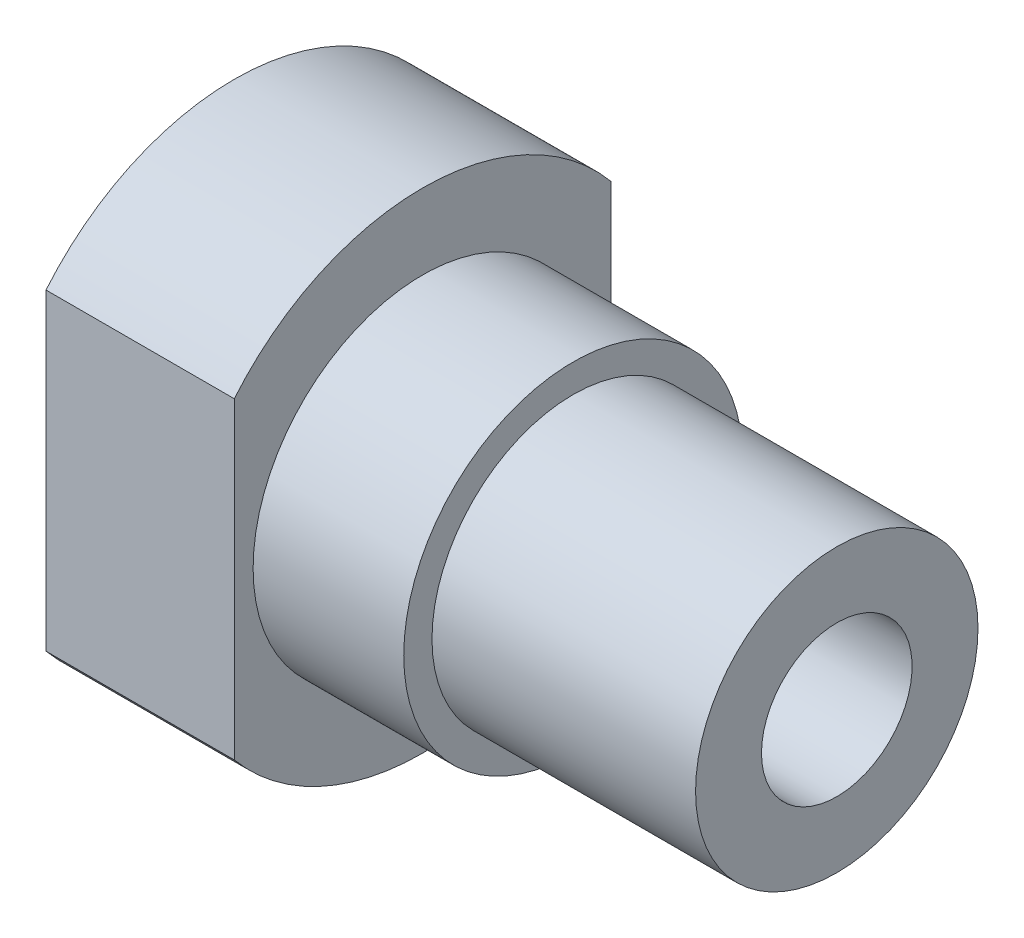
from build123d import *

# Parameters (mm, degrees)
CUT_EXTRUDE_1_DEPTH = 15.335271187


with BuildPart() as part:
    # Эскиз1 → Повернуть1 (revolve)
    with BuildSketch(Plane.XY, mode=Mode.PRIVATE) as revolve_1_sk:
        Polygon((0, 4), (2, 4), (2, 2.5), (6, 2.5), (6, 2), (16, 2), (16, 3.75), (9, 3.75), (9, 4.5), (5, 4.5), (5, 6.5), (0, 6.5), align=None)
    revolve(revolve_1_sk.sketch.rotate(Axis((0, 0, 0), (1, 0, 0)), 90), axis=Axis((0, 0, 0), (1, 0, 0)))

    # Эскиз2 → Вырез-Вытянуть1 (cut, through all)
    with BuildSketch(Plane(origin=(5, 0, 0), x_dir=(0, 0, -1), z_dir=(1, 0, 0))):
        with BuildLine():
            ThreePointArc((-5, 4.153311931), (-6.5, 0), (-5, -4.153311931))
            Line((-5, -4.153311931), (-5, 4.153311931))
        make_face()
        with BuildLine():
            Line((5, 4.153311931), (5, -4.153311931))
            ThreePointArc((5, -4.153311931), (6.11350963, -2.207940217), (6.5, 0))
            ThreePointArc((6.5, 0), (6.11350963, 2.207940217), (5, 4.153311931))
        make_face()
    extrude(amount=-CUT_EXTRUDE_1_DEPTH, mode=Mode.SUBTRACT)


solid = part.part
